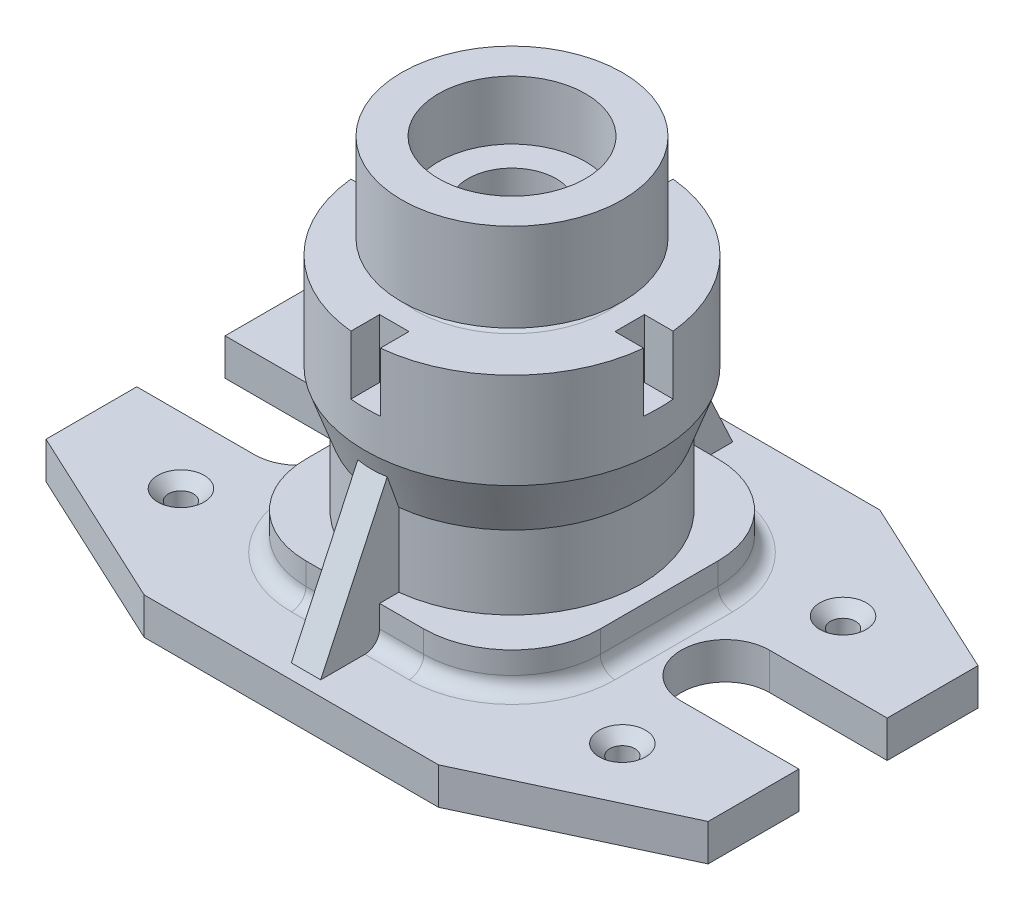
from build123d import *

# Parameters (mm, degrees)
BOSS_EXTRUDE1_DEPTH                                 = 5
CSK_FOR_M3_COUNTERSUNK_FLAT_HEAD_SCREW1_D           = 3.4
CSK_FOR_M3_COUNTERSUNK_FLAT_HEAD_SCREW1_CSINK_D     = 6.3
CSK_FOR_M3_COUNTERSUNK_FLAT_HEAD_SCREW1_CSINK_ANGLE = 90
BOSS_EXTRUDE2_DEPTH                                 = 5
FILLET1_R                                           = 2
SKETCH8_R                                           = 8
CUT_EXTRUDE1_DEPTH                                  = 56
RIB1_REACH                                          = 78.426
SKETCH10_WALL_W                                     = 176.100560442
SKETCH10_WALL_H                                     = 4
SKETCH11_W                                          = 4
SKETCH11_H                                          = 4
CUT_EXTRUDE2_DEPTH                                  = 8
CIRPATTERN1_COUNT                                   = 4


with BuildPart() as part:
    # Sketch2 → Boss-Extrude1 (new body)
    with BuildSketch(Plane(origin=(0, 0, 0), x_dir=(1, 0, 0), z_dir=(0, 1, 0))):
        with BuildLine():
            Line((-20, 30), (20, 30))
            Line((20, 30), (45, 18.342308546))
            Line((45, 18.342308546), (45, 6))
            Line((45, 6), (29, 6))
            ThreePointArc((29, 6), (23, 0), (29, -6))
            Line((29, -6), (45, -6))
            Line((45, -6), (45, -18.342308546))
            Line((45, -18.342308546), (20, -30))
            Line((20, -30), (-20, -30))
            Line((-20, -30), (-45, -18.342308546))
            Line((-45, -18.342308546), (-45, -6))
            Line((-45, -6), (-29, -6))
            ThreePointArc((-29, -6), (-23, 0), (-29, 6))
            Line((-29, 6), (-45, 6))
            Line((-45, 6), (-45, 18.342308546))
            Line((-45, 18.342308546), (-20, 30))
        make_face()
    extrude(amount=BOSS_EXTRUDE1_DEPTH)

    # CSK for M3 Countersunk Flat Head Screw1 (through all)
    with Locations(Plane(origin=(0, 5, 0), x_dir=(1, 0, 0), z_dir=(0, 1, 0))):
        with Locations((-30, 15), (30, -15), (30, 15), (-30, -15)):
            CounterSinkHole(CSK_FOR_M3_COUNTERSUNK_FLAT_HEAD_SCREW1_D / 2, CSK_FOR_M3_COUNTERSUNK_FLAT_HEAD_SCREW1_CSINK_D / 2, counter_sink_angle=CSK_FOR_M3_COUNTERSUNK_FLAT_HEAD_SCREW1_CSINK_ANGLE)

    # Sketch6 → Boss-Extrude2 (add)
    with BuildSketch(Plane(origin=(0, 5, 0), x_dir=(1, 0, 0), z_dir=(0, 1, 0))):
        with BuildLine():
            Line((-8, -20), (8, -20))
            ThreePointArc((8, -20), (16.485281374, -16.485281374), (20, -8))
            Line((20, -8), (20, 8))
            ThreePointArc((20, 8), (16.485281374, 16.485281374), (8, 20))
            Line((8, 20), (-8, 20))
            ThreePointArc((-8, 20), (-16.485281374, 16.485281374), (-20, 8))
            Line((-20, 8), (-20, -8))
            ThreePointArc((-20, -8), (-16.485281374, -16.485281374), (-8, -20))
        make_face()
    extrude(amount=BOSS_EXTRUDE2_DEPTH)

    # Fillet1
    fillet1_edges = [part.edges().sort_by_distance(p)[0] for p in [
        (-16.485281374, 5, 16.485281374),
        (0, 5, 20),
        (16.485281374, 5, 16.485281374),
        (20, 5, 0),
        (16.485281374, 5, -16.485281374),
        (0, 5, -20),
        (-16.485281374, 5, -16.485281374),
        (-20, 5, 0),
    ]]
    fillet(fillet1_edges, radius=FILLET1_R)

    # Sketch8 → Cut-Extrude1 (cut, through all)
    with BuildSketch(Plane.XZ):
        with Locations(Location((0, 0, 0), (0, 0, 270))):
            Circle(SKETCH8_R)
    extrude(amount=-CUT_EXTRUDE1_DEPTH, mode=Mode.SUBTRACT)

    # Sketch9 → Revolve1 (revolve)
    with BuildSketch(Plane.XY, mode=Mode.PRIVATE) as revolve1_sk:
        with BuildLine():
            Line((-8, 10), (-17.5, 10))
            Line((-17.5, 10), (-17.5, 20))
            Line((-17.5, 20), (-20, 27))
            Line((-20, 27), (-20, 40))
            Line((-20, 40), (-13.1, 40))
            ThreePointArc((-13.1, 40), (-12.1, 41), (-13.1, 42))
            Line((-13.1, 42), (-15, 42))
            Line((-15, 42), (-15, 54))
            Line((-15, 54), (-10, 54))
            Line((-10, 54), (-10, 46))
            Line((-10, 46), (-6, 46))
            Line((-6, 46), (-6, 34))
            Line((-6, 34), (-8, 28))
            Line((-8, 28), (-8, 10))
        make_face()
    revolve(revolve1_sk.sketch.rotate(Axis((0, -7.60274032, 0), (0, 1, 0)), 270), axis=Axis((0, -7.60274032, 0), (0, 1, 0)))

    # Sketch10 wall → Rib1 (add, up to next)
    with BuildSketch(Plane(origin=(0, 14.628473456, 23.510169091), x_dir=(0, 0.906307787042, -0.42261826173), z_dir=(0, 0.42261826173, 0.906307787042)), mode=Mode.PRIVATE) as rib1_sk1:
        Rectangle(SKETCH10_WALL_W, SKETCH10_WALL_H)
    rib1_tool1 = extrude(rib1_sk1.sketch, amount=-RIB1_REACH, mode=Mode.PRIVATE) - part.part
    rib1 = rib1_tool1.solids().sort_by_distance((0, 14.628473456, 23.510169091))[0]
    add(rib1)

    # Mirror1: Rib1 across plane
    add(rib1.mirror(Plane.XY))

    # Sketch11 → Cut-Extrude2 (cut)
    with BuildSketch(Plane(origin=(0, 40, 0), x_dir=(1, 0, 0), z_dir=(0, 1, 0))):
        with Locations((18, 0)):
            Rectangle(SKETCH11_W, SKETCH11_H)
    cut_extrude2 = extrude(amount=-CUT_EXTRUDE2_DEPTH, mode=Mode.SUBTRACT)

    # CirPattern1: Cut-Extrude2 ×4 about axis
    cirpattern1_axis = Axis((0, 0, 0), (0, 1, 0))
    for i in range(1, CIRPATTERN1_COUNT):
        add(cut_extrude2.rotate(cirpattern1_axis, i * 360 / CIRPATTERN1_COUNT), mode=Mode.SUBTRACT)


solid = part.part
